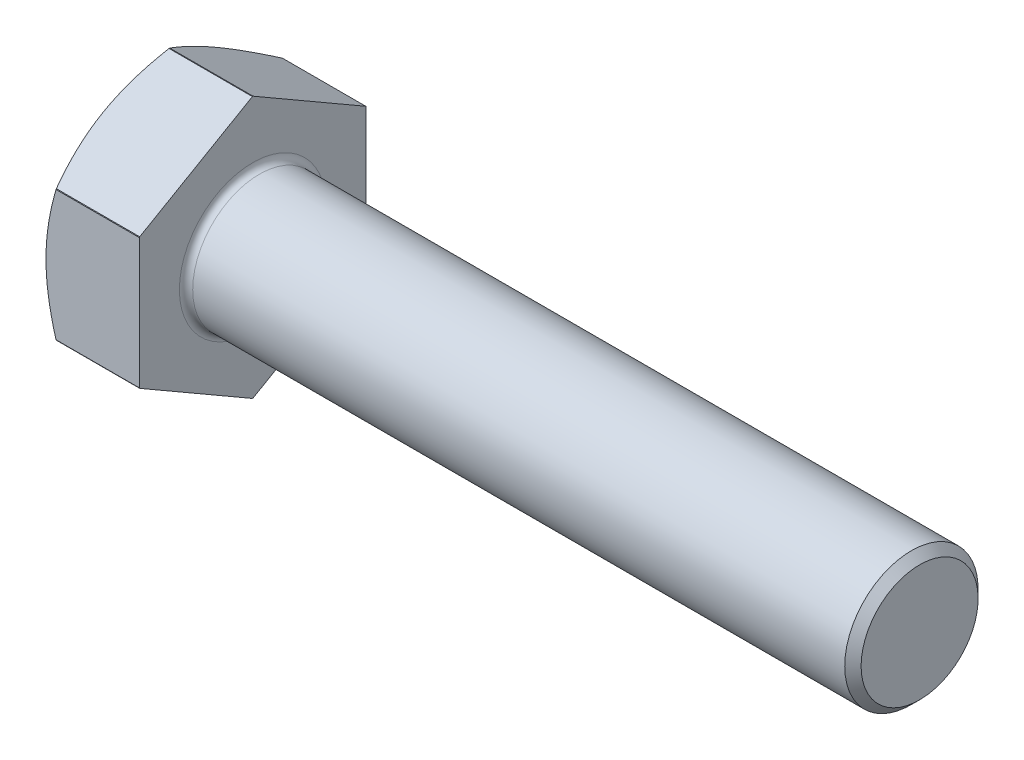
from build123d import *

# Parameters (mm, degrees)
SKETCH2_W          = 39.2
SKETCH2_H          = 39.2
CUT_EXTRUDE1_DEPTH = 7


with BuildPart() as part:
    # Sketch1 → Revolve1 (revolve)
    with BuildSketch(Plane.XY, mode=Mode.PRIVATE) as revolve1_sk:
        with BuildLine():
            Line((-7, 0), (-7, 8.5))
            Line((-7, 8.5), (-6.24944465, 9.8))
            Line((-6.24944465, 9.8), (0, 9.8))
            Line((0, 9.8), (0, 5.5))
            ThreePointArc((0, 5.5), (0.146446609, 5.146446609), (0.5, 5))
            Line((0.5, 5), (49.3865, 5))
            Line((49.3865, 5), (50, 4.3865))
            Line((50, 4.3865), (50, 0))
            Line((50, 0), (-7, 0))
        make_face()
    revolve(revolve1_sk.sketch.rotate(Axis((50, 0, 0), (-1, 0, 0)), 270), axis=Axis((50, 0, 0), (-1, 0, 0)))

    # Sketch2 → Cut-Extrude1 (cut)
    with BuildSketch(Plane(origin=(0, 0, 0), x_dir=(0, 0, -1), z_dir=(1, 0, 0))):
        Rectangle(SKETCH2_W, SKETCH2_H)
        Polygon((-8.5, 4.907477288), (-8.5, -4.907477288), (0, -9.814954576), (8.5, -4.907477288), (8.5, 4.907477288), (0, 9.814954576), align=None, mode=Mode.SUBTRACT)
    extrude(amount=-CUT_EXTRUDE1_DEPTH, mode=Mode.SUBTRACT)


solid = part.part
